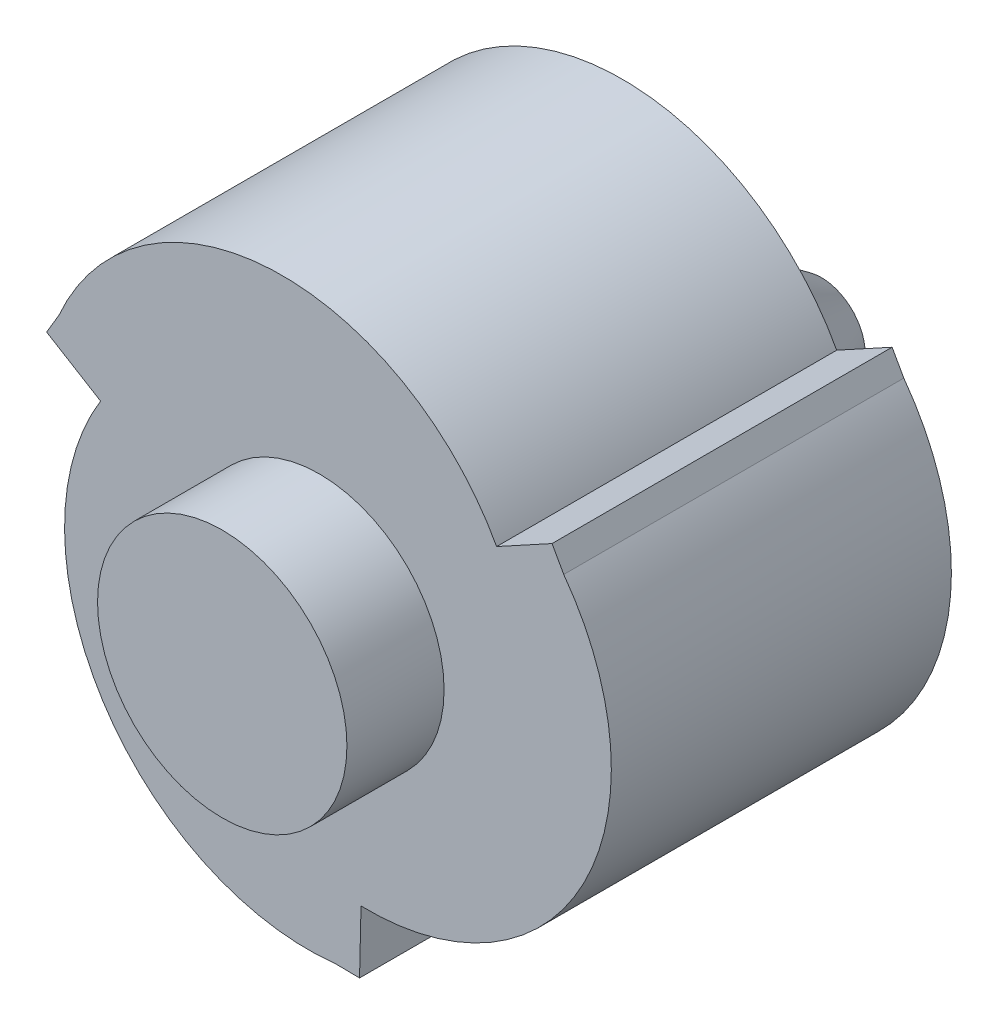
from build123d import *

# Parameters (mm, degrees)
SALIENTE_EXTRUIR1_DEPTH = 18
SALIENTE_EXTRUIR2_START = 1.5
CROQUIS2_R              = 2.7
SALIENTE_EXTRUIR2_DEPTH = 1.5
SALIENTE_EXTRUIR3_DEPTH = 1.5
CROQUIS6_W              = 5.4
CROQUIS6_H              = 1.181933233
SALIENTE_EXTRUIR7_DEPTH = 10
CROQUIS7_W              = 5.4
CROQUIS7_H              = 10
CORTAR_EXTRUIR2_DEPTH   = 16.5


with BuildPart() as part:
    # Croquis1 → Saliente-Extruir1 (new body)
    with BuildSketch(Plane.XY):
        with BuildLine():
            Line((-54.535099114, 31.482780649), (-55.25791247, 32.775048384))
            Line((-55.25791247, 32.775048384), (-58.679569293, 30.903614553))
            ThreePointArc((-58.679569293, 30.903614553), (-72.555259572, 38.768368337), (-85.712228427, 29.752642999))
            Line((-85.712228427, 29.752642999), (-86.469958437, 28.480534403))
            Line((-86.469958437, 28.480534403), (-83.138420786, 26.453009587))
            ThreePointArc((-83.138420786, 26.453009587), (-83.011652218, 10.503932418), (-68.625320614, 3.617525822))
            Line((-68.625320614, 3.617525822), (-67.144777249, 3.597366682))
            Line((-67.144777249, 3.597366682), (-67.054658077, 7.49632533))
            ThreePointArc((-67.054658077, 7.49632533), (-53.305736365, 15.580648714), (-54.535099114, 31.482780649))
        make_face()
        with BuildLine():
            Line((-69.624216052, 5.117649823), (-68.624216052, 5.117649823))
            Line((-68.624216052, 5.117649823), (-68.624216052, 9.117649823))
            ThreePointArc((-68.624216052, 9.117649823), (-55.305921191, 15.218525867), (-55.334796889, 29.867649823))
            Line((-55.334796889, 29.867649823), (-55.834796889, 30.733675227))
            Line((-55.834796889, 30.733675227), (-59.298898504, 28.733675227))
            ThreePointArc((-59.298898504, 28.733675227), (-71.241559574, 37.21721889), (-83.913635214, 29.867649823))
            Line((-83.913635214, 29.867649823), (-84.413635214, 29.001624419))
            Line((-84.413635214, 29.001624419), (-80.949533599, 27.001624419))
            ThreePointArc((-80.949533599, 27.001624419), (-82.325167391, 12.417204713), (-69.624216052, 5.117649823))
        make_face(mode=Mode.SUBTRACT)
    extrude(amount=SALIENTE_EXTRUIR1_DEPTH)

    # Croquis2 → Saliente-Extruir2 (add)
    with BuildSketch(Plane(origin=(0, 0, 0), x_dir=(-1, 0, 0), z_dir=(0, 0, -1)).offset(SALIENTE_EXTRUIR2_START)):
        with BuildLine():
            Line((67.054658077, 7.49632533), (67.144777249, 3.597366682))
            Line((67.144777249, 3.597366682), (68.625320614, 3.617525822))
            ThreePointArc((68.625320614, 3.617525822), (83.011652218, 10.503932418), (83.138420786, 26.453009587))
            Line((83.138420786, 26.453009587), (86.469958437, 28.480534403))
            Line((86.469958437, 28.480534403), (85.712228427, 29.752642999))
            ThreePointArc((85.712228427, 29.752642999), (72.555259572, 38.768368337), (58.679569293, 30.903614553))
            Line((58.679569293, 30.903614553), (55.25791247, 32.775048384))
            Line((55.25791247, 32.775048384), (54.535099114, 31.482780649))
            ThreePointArc((54.535099114, 31.482780649), (53.305736365, 15.580648714), (67.054658077, 7.49632533))
        make_face()
        with Locations((69.624216052, 21.617649823)):
            Circle(CROQUIS2_R, mode=Mode.SUBTRACT)
    extrude(amount=-SALIENTE_EXTRUIR2_DEPTH)

    # Croquis3 → Saliente-Extruir3 (add)
    with BuildSketch(Plane.XY.offset(18)):
        with BuildLine():
            Line((-67.144777249, 3.597366682), (-67.054658077, 7.49632533))
            ThreePointArc((-67.054658077, 7.49632533), (-53.305736365, 15.580648714), (-54.535099114, 31.482780649))
            Line((-54.535099114, 31.482780649), (-55.25791247, 32.775048384))
            Line((-55.25791247, 32.775048384), (-58.679569293, 30.903614553))
            ThreePointArc((-58.679569293, 30.903614553), (-72.555259572, 38.768368337), (-85.712228427, 29.752642999))
            Line((-85.712228427, 29.752642999), (-86.469958437, 28.480534403))
            Line((-86.469958437, 28.480534403), (-83.138420786, 26.453009587))
            ThreePointArc((-83.138420786, 26.453009587), (-83.011652218, 10.503932418), (-68.625320614, 3.617525822))
            Line((-68.625320614, 3.617525822), (-67.144777249, 3.597366682))
        make_face()
    extrude(amount=SALIENTE_EXTRUIR3_DEPTH)

    # Croquis6 → Saliente-Extruir7 (add)
    with BuildSketch(Plane(origin=(0, 0, -1.5), x_dir=(-1, 0, 0), z_dir=(0, 0, -1))):
        with Locations((69.624216052, 21.026683207)):
            Rectangle(CROQUIS6_W, CROQUIS6_H)
    extrude(amount=SALIENTE_EXTRUIR7_DEPTH)

    # Croquis7 → Cortar-Extruir2 (cut)
    with BuildSketch(Plane(origin=(0, 21.617649823, 0), x_dir=(1, 0, 0), z_dir=(0, 1, 0))):
        with Locations((-69.624216052, 6.5)):
            Rectangle(CROQUIS7_W, CROQUIS7_H)
    extrude(amount=-CORTAR_EXTRUIR2_DEPTH, mode=Mode.SUBTRACT)

    # Croquis8 → Revolución1 (revolve)
    with BuildSketch(Plane(origin=(0, 21.617649823, 0), x_dir=(1, 0, 0), z_dir=(0, 1, 0)), mode=Mode.PRIVATE) as revoluci_n1_sk:
        Polygon((-72.324216052, 1.5), (-79.486781688, 1.5), (-72.324216052, 11.5), align=None)
        Polygon((-72.324216052, -19.5), (-69.624216052, -19.5), (-69.624216052, -25.5), (-72.324216052, -25.5), (-77.324216052, -25.5), (-77.324216052, -19.5), align=None)
    revolve(revoluci_n1_sk.sketch.rotate(Axis((-69.624216052, 21.617649823, 19.5), (0, 0, 1)), 180), axis=Axis((-69.624216052, 21.617649823, 19.5), (0, 0, 1)))


solid = part.part
